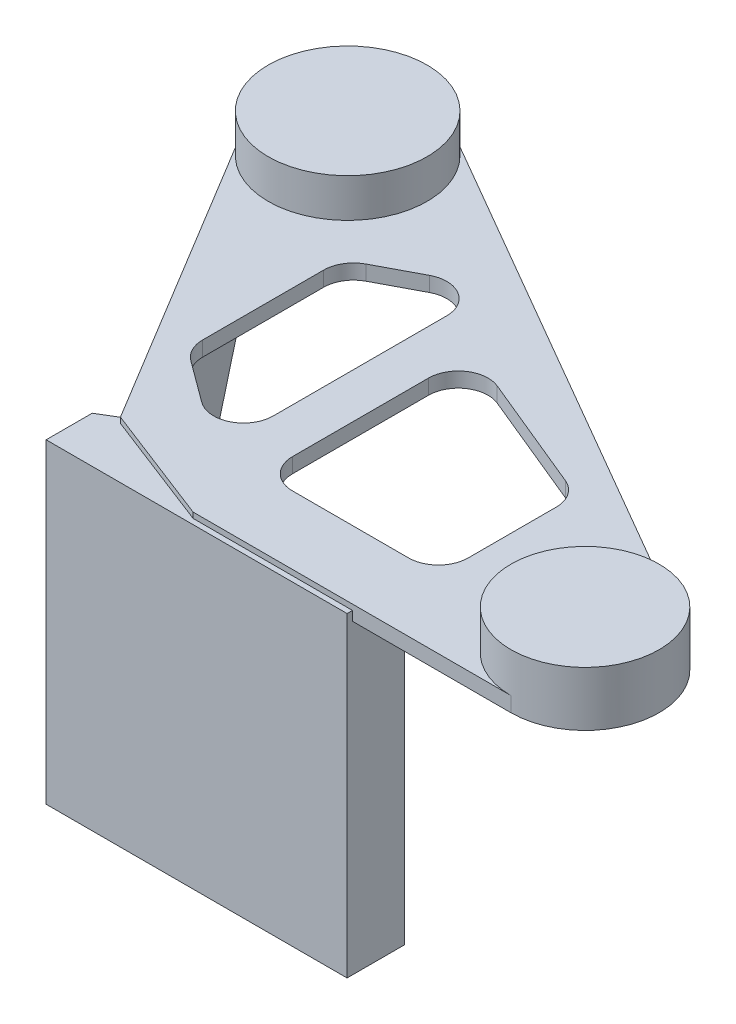
from build123d import *

# Parameters (mm, degrees)
BOSS_EXTRUDE1_DEPTH      = 15
BOSS_EXTRUDE4_DEPTH      = 15
SKETCH4_R                = 74.621477326
BOSS_EXTRUDE5_DEPTH      = 40
BOSS_EXTRUDE6_DEPTH      = 39
BOSS_EXTRUDE6_DEPTH_BACK = 30
SKETCH5_R                = 80
SKETCH6_W                = 285
SKETCH6_H                = 317.784796746
BOSS_EXTRUDE7_DEPTH      = 58
SKETCH7_W                = 58
SKETCH7_H                = 317.784796746
BOSS_EXTRUDE8_DEPTH      = 18
CUT_EXTRUDE1_DEPTH       = 38
CUT_EXTRUDE2_DEPTH       = 40
CUT_EXTRUDE3_DEPTH       = 40


with BuildPart() as part:
    # Sketch2 → Boss-Extrude1 (new body)
    with BuildSketch(Plane(origin=(0, 0, 0), x_dir=(1, 0, 0), z_dir=(0, 1, 0))):
        with BuildLine():
            Line((-394.16764822, 144.558066887), (-218.183914618, -146.353819271))
            Line((-218.183914618, -146.353819271), (-98.815198039, -192.561064398))
            Line((-98.815198039, -192.561064398), (221.184801961, -192.561064398))
            ThreePointArc((221.184801961, -192.561064398), (293.251171088, -137.299424858), (258.578680134, -53.363564019))
            Line((258.578680134, -53.363564019), (-291.748563496, 265.313073699))
            ThreePointArc((-291.748563496, 265.313073699), (-389.784746311, 251.238170024), (-399.006244391, 152.627014328))
            Line((-399.006244391, 152.627014328), (-394.16764822, 144.558066887))
        make_face()
    extrude(amount=BOSS_EXTRUDE1_DEPTH)

    # Sketch3 → Boss-Extrude4 (add)
    with BuildSketch(Plane(origin=(-224.546191977, 0, 135.83658527), x_dir=(0.5175992164748091, 0, 0.8556231945808059), z_dir=(-0.8556231945808059, 0, 0.5175992164748091))):
        Polygon((-327.70810087, 0), (-327.70810087, -65), (-7.70810087, -308.318721022), (12.29189913, -308.318721022), (12.29189913, 0), align=None)
    extrude(amount=-BOSS_EXTRUDE4_DEPTH)

    # Sketch4 → Boss-Extrude5 (add)
    with BuildSketch(Plane(origin=(0, 15, 0), x_dir=(1, 0, 0), z_dir=(0, 1, 0))):
        with Locations(Location((221.184801961, -117.939587072, 0), (0, 0, 270))):
            Circle(SKETCH4_R)
    extrude(amount=BOSS_EXTRUDE5_DEPTH)

    # Sketch5 → Boss-Extrude6 (add, two sides: drawn at the far end of the back side and taken through both)
    with BuildSketch(Plane(origin=(0, 15, 0), x_dir=(1, 0, 0), z_dir=(0, 1, 0)).offset(-BOSS_EXTRUDE6_DEPTH_BACK)):
        with Locations(Location((-331.837695487, 196.082578278, 0), (0, 0, 59.926261021))):
            Circle(SKETCH5_R)
    extrude(amount=BOSS_EXTRUDE6_DEPTH + BOSS_EXTRUDE6_DEPTH_BACK)



with BuildPart() as body_2:
    # Sketch6 → Boss-Extrude7 (new body)
    with BuildSketch(Plane.XY.offset(140)):
        with Locations((-80.859906783, -149.426322649)):
            Rectangle(SKETCH6_W, SKETCH6_H)
    extrude(amount=BOSS_EXTRUDE7_DEPTH)


with BuildPart() as part_1:
    add(part.part)

    add(body_2.part)  # Boss-Extrude8 merges body 2
    # Sketch7 → Boss-Extrude8 (add)
    with BuildSketch(Plane.ZY.offset(223.359906783)):
        with Locations((169, -149.426322649)):
            Rectangle(SKETCH7_W, SKETCH7_H)
    extrude(amount=BOSS_EXTRUDE8_DEPTH)

    # Sketch9 → Cut-Extrude1 (cut)
    with BuildSketch(Plane(origin=(-224.546191977, 0, 135.83658527), x_dir=(0.5175992164748091, 0, 0.8556231945808059), z_dir=(-0.8556231945808059, 0, 0.5175992164748091))):
        Polygon((12.29189913, 9.466075724), (12.29189913, 15), (-327.70810087, 15), (-327.70810087, 0), (-327.70810087, -65), (-7.70810087, -308.318721022), (4.865944211, -308.318721022), (4.865944211, 9.466075724), align=None)
    extrude(amount=CUT_EXTRUDE1_DEPTH, mode=Mode.SUBTRACT)

    # Sketch10 → Cut-Extrude2 (cut)
    with BuildSketch(Plane(origin=(0, 15, 0), x_dir=(1, 0, 0), z_dir=(0, 1, 0))):
        with BuildLine():
            Line((-97.14787354, 42.774374036), (-97.14787354, -94.085056358))
            ThreePointArc((-97.14787354, -94.085056358), (-88.361076975, -115.298259793), (-67.14787354, -124.085056358))
            Line((-67.14787354, -124.085056358), (49.666916597, -124.085056358))
            ThreePointArc((49.666916597, -124.085056358), (70.880120033, -115.298259793), (79.666916597, -94.085056358))
            Line((79.666916597, -94.085056358), (79.666916597, -5.425903448))
            ThreePointArc((79.666916597, -5.425903448), (74.599667277, 11.258159113), (61.109720362, 22.306068029))
            Line((61.109720362, 22.306068029), (-55.705069775, 70.506345513))
            ThreePointArc((-55.705069775, 70.506345513), (-83.8319361, 67.707124716), (-97.14787354, 42.774374036))
        make_face()
    extrude(amount=-CUT_EXTRUDE2_DEPTH, mode=Mode.SUBTRACT)

    # Sketch11 → Cut-Extrude3 (cut)
    with BuildSketch(Plane(origin=(0, 15, 0), x_dir=(1, 0, 0), z_dir=(0, 1, 0))):
        with BuildLine():
            Line((-244.09918706, 84.19324728), (-244.09918706, -37.62523405))
            ThreePointArc((-244.09918706, -37.62523405), (-240.870349139, -51.164247343), (-231.878861664, -61.788908667))
            Line((-231.878861664, -61.788908667), (-190.041122138, -92.57319155))
            ThreePointArc((-190.041122138, -92.57319155), (-158.722434241, -95.180679012), (-142.261447534, -68.409516933))
            Line((-142.261447534, -68.409516933), (-142.261447534, 106.276406253))
            ThreePointArc((-142.261447534, 106.276406253), (-156.771361146, 131.9679851), (-186.265262446, 132.807391307))
            Line((-186.265262446, 132.807391307), (-228.103001972, 110.724232334))
            ThreePointArc((-228.103001972, 110.724232334), (-239.790765908, 99.683333669), (-244.09918706, 84.19324728))
        make_face()
    extrude(amount=-CUT_EXTRUDE3_DEPTH, mode=Mode.SUBTRACT)


solid = part_1.part
